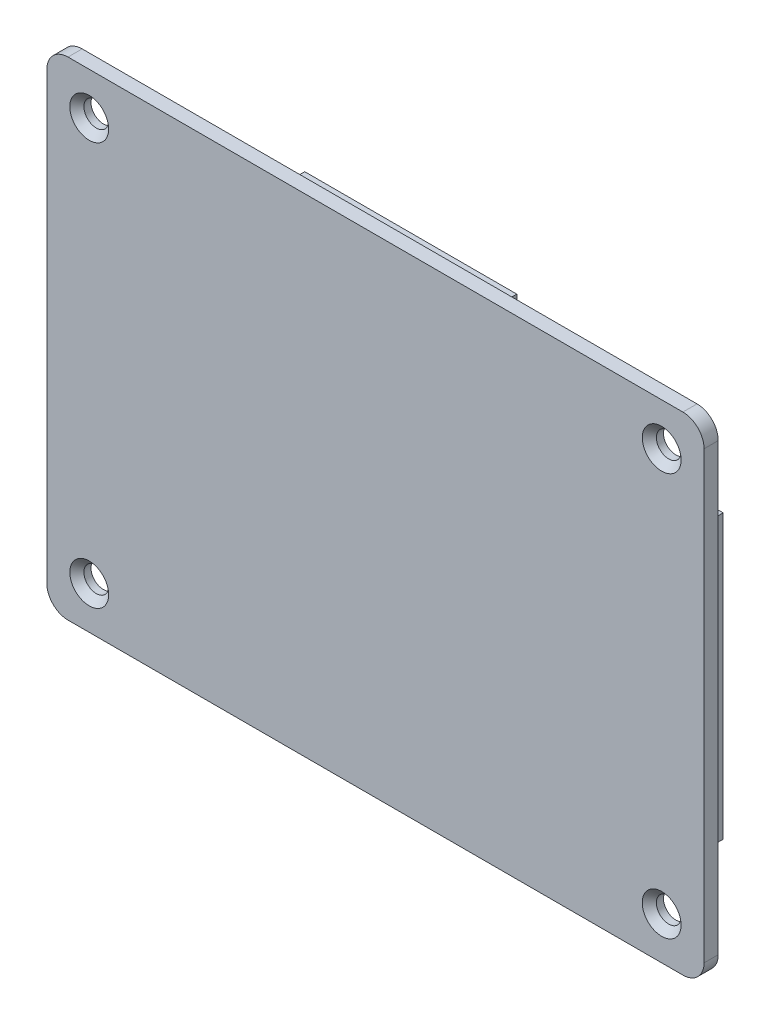
from build123d import *

# Parameters (mm, degrees)
BOSS_EXTRUDE1_DEPTH = 2
SKETCH3_W           = 2
SKETCH3_H           = 40
SKETCH3_W_2         = 30
SKETCH3_H_2         = 2
BOSS_EXTRUDE2_DEPTH = 3
SKETCH4_R           = 1.75
CUT_EXTRUDE1_DEPTH  = 3
CHAMFER1_SIZE       = 1


with BuildPart() as part:
    # Sketch1 → Boss-Extrude1 (new body)
    with BuildSketch(Plane.XY):
        with BuildLine():
            Line((65.230528188, -85.753133266), (65.230528188, -22.753132266))
            ThreePointArc((65.230528188, -22.753132266), (64.351848531, -20.631811922), (62.230528188, -19.753132266))
            Line((62.230528188, -19.753132266), (-24.769470492, -19.753132266))
            ThreePointArc((-24.769470492, -19.753132266), (-26.890790836, -20.631811922), (-27.769470492, -22.753132266))
            Line((-27.769470492, -22.753132266), (-27.769470492, -85.753133266))
            ThreePointArc((-27.769470492, -85.753133266), (-26.890790836, -87.874453609), (-24.769470492, -88.753133266))
            Line((-24.769470492, -88.753133266), (62.230528188, -88.753133266))
            ThreePointArc((62.230528188, -88.753133266), (64.351848531, -87.874453609), (65.230528188, -85.753133266))
        make_face()
    extrude(amount=BOSS_EXTRUDE1_DEPTH)

    # Sketch3 → Boss-Extrude2 (add)
    with BuildSketch(Plane(origin=(0, 0, 0), x_dir=(-1, 0, 0), z_dir=(0, 0, -1))):
        with Locations((-61.930528188, -54.253132766)):
            Rectangle(SKETCH3_W, SKETCH3_H)
        with Locations((24.469470492, -54.253132766)):
            Rectangle(SKETCH3_W, SKETCH3_H)
        with Locations((-18.730528848, -23.053132266)):
            Rectangle(SKETCH3_W_2, SKETCH3_H_2)
        with Locations((-18.730528848, -85.453133266)):
            Rectangle(SKETCH3_W_2, SKETCH3_H_2)
    extrude(amount=BOSS_EXTRUDE2_DEPTH)

    # Sketch4 → Cut-Extrude1 (cut)
    with BuildSketch(Plane(origin=(0, 0, 0), x_dir=(-1, 0, 0), z_dir=(0, 0, -1))):
        with Locations((-59.230528188, -25.753132266)):
            Circle(SKETCH4_R)
        with Locations((21.769470706, -25.703133912)):
            Circle(SKETCH4_R)
        with Locations((21.769470492, -82.753133266)):
            Circle(SKETCH4_R)
        with Locations((-59.230528188, -82.753133266)):
            Circle(SKETCH4_R)
    extrude(amount=-CUT_EXTRUDE1_DEPTH, mode=Mode.SUBTRACT)

    # Chamfer1
    chamfer1_edges = [part.edges().sort_by_distance(p)[0] for p in [
        (60.980528188, -82.753133266, 2),
        (-20.019470492, -82.753133266, 2),
        (-20.019470706, -25.703133912, 2),
        (60.980528188, -25.753132266, 2),
    ]]
    chamfer(chamfer1_edges, length=CHAMFER1_SIZE)


solid = part.part
